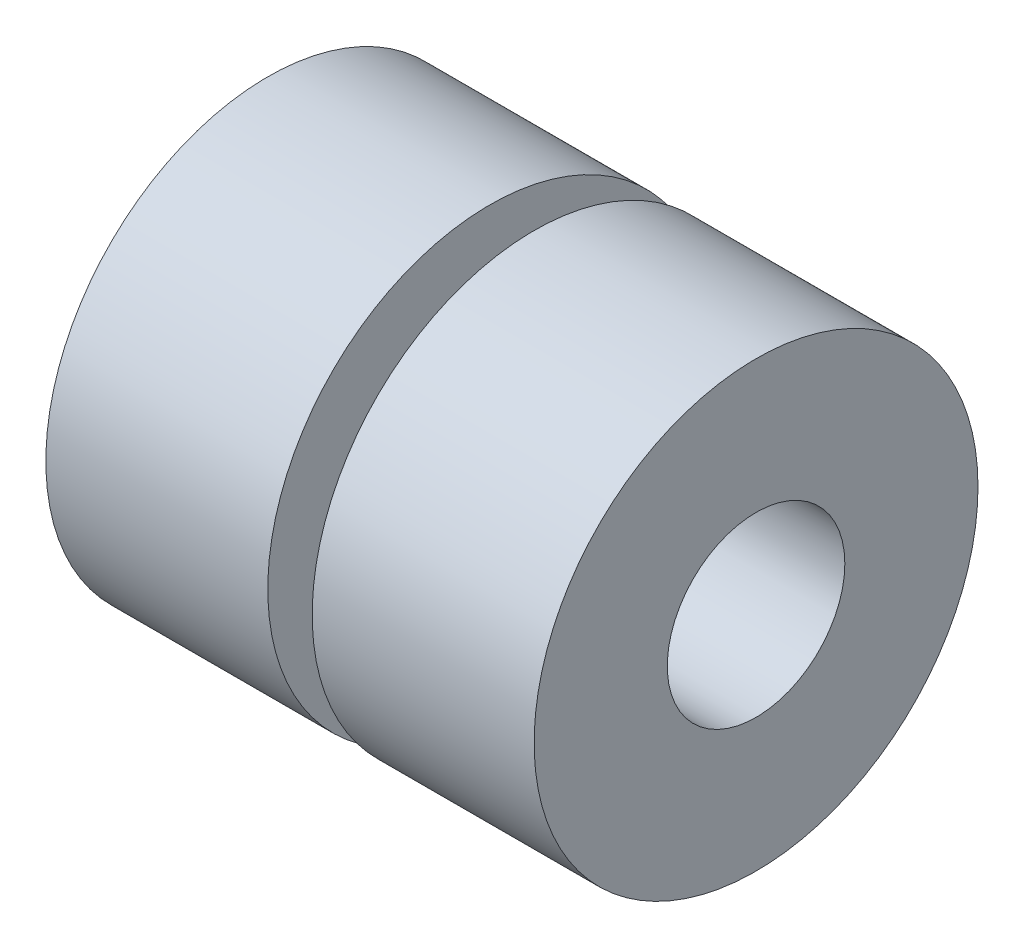
from build123d import *

# Parameters (mm, degrees)
SKETCH_1_R          = 5
EXTRUDE_1_DEPTH     = 5
SKETCH_2_R          = 2.5
EXTRUDE_2_DEPTH     = 1
SKETCH_3_R          = 5
EXTRUDE_3_DEPTH     = 5
SKETCH_4_R          = 2
CUT_EXTRUDE_1_DEPTH = 16


with BuildPart() as part:
    # Эскиз1 → Бобышка-Вытянуть1 (new body)
    with BuildSketch(Plane(origin=(0, 0, 0), x_dir=(0, 0, -1), z_dir=(1, 0, 0))):
        Circle(SKETCH_1_R)
    extrude(amount=EXTRUDE_1_DEPTH)

    # Эскиз2 → Бобышка-Вытянуть2 (add)
    with BuildSketch(Plane(origin=(5, 0, 0), x_dir=(0, 0, -1), z_dir=(1, 0, 0))):
        Circle(SKETCH_2_R)
    extrude(amount=EXTRUDE_2_DEPTH)

    # Эскиз3 → Бобышка-Вытянуть3 (add)
    with BuildSketch(Plane(origin=(6, 0, 0), x_dir=(0, 0, -1), z_dir=(1, 0, 0))):
        Circle(SKETCH_3_R)
    extrude(amount=EXTRUDE_3_DEPTH)

    # Эскиз4 → Вырез-Вытянуть1 (cut)
    with BuildSketch(Plane(origin=(11, 0, 0), x_dir=(0, 0, -1), z_dir=(1, 0, 0))):
        Circle(SKETCH_4_R)
    extrude(amount=-CUT_EXTRUDE_1_DEPTH, mode=Mode.SUBTRACT)


solid = part.part
